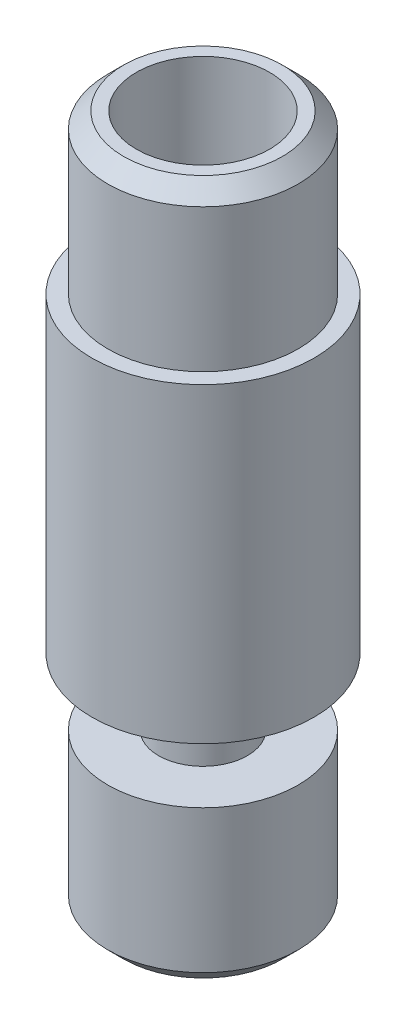
from build123d import *


with BuildPart() as part:
    # Sketch1 → Revolve1 (revolve)
    with BuildSketch(Plane(origin=(0, 0, 0), x_dir=(-1, 0, 0), z_dir=(0, 0, -1)), mode=Mode.PRIVATE) as revolve1_sk:
        Polygon((-2.5, 0), (-1, 0), (-1, 15.8), (-2.1, 16.9), (-2.1, 21.9), (-2.5, 21.9), (-3, 21.4), (-3, 16.9), (-3.5, 16.9), (-3.5, 7.1), (-1.4, 7.1), (-1.4, 5), (-3, 5), (-3, 0.5), align=None)
    revolve(revolve1_sk.sketch.rotate(Axis((0, 0, 0), (0, 1, 0)), 270), axis=Axis((0, 0, 0), (0, 1, 0)))


solid = part.part
